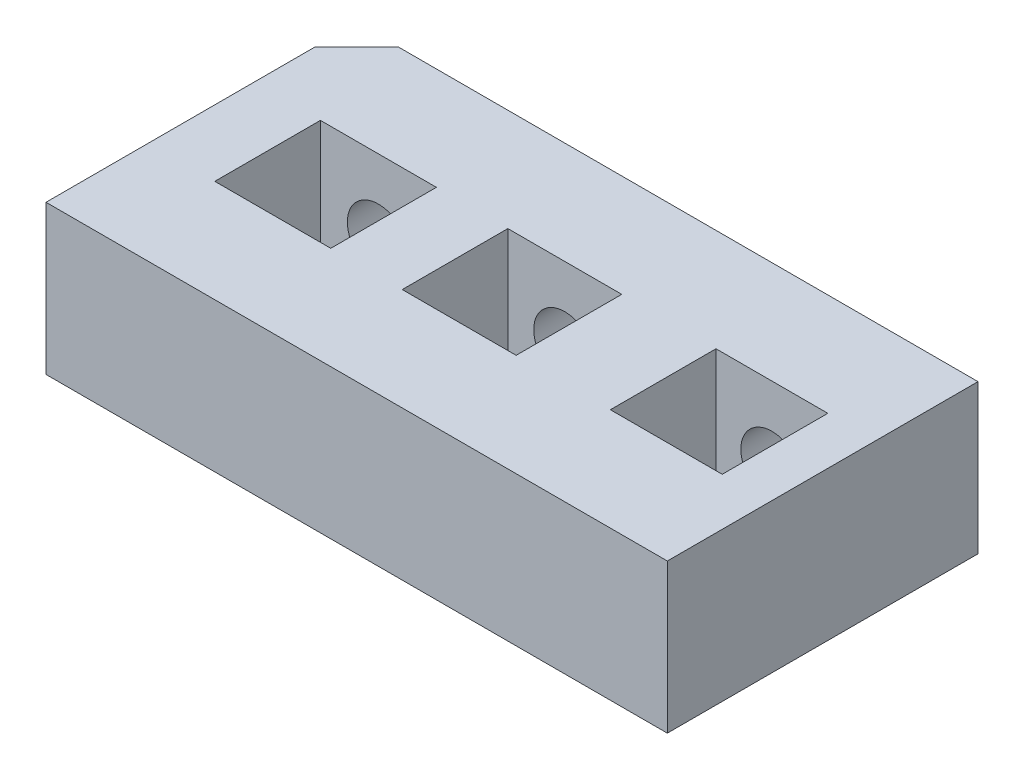
from build123d import *

# Parameters (mm, degrees)
SKETCH1_W           = 30
SKETCH1_H           = 15
BOSS_EXTRUDE1_DEPTH = 7.2
SKETCH2_W           = 5.6
SKETCH2_H           = 5.1
SKETCH2_W_2         = 5.5
SKETCH2_W_3         = 5.4
CUT_EXTRUDE1_DEPTH  = 7.2
SKETCH4_R           = 1.5
CUT_EXTRUDE2_DEPTH  = 7.2
CHAMFER1_SIZE       = 2


with BuildPart() as part:
    # Sketch1 → Boss-Extrude1 (new body)
    with BuildSketch(Plane(origin=(0, 0, 0), x_dir=(1, 0, 0), z_dir=(0, 1, 0))):
        Rectangle(SKETCH1_W, SKETCH1_H)
    extrude(amount=BOSS_EXTRUDE1_DEPTH)

    # Sketch2 → Cut-Extrude1 (cut)
    with BuildSketch(Plane(origin=(0, 7.2, 0), x_dir=(1, 0, 0), z_dir=(0, 1, 0))):
        with Locations((-9, 0)):
            Rectangle(SKETCH2_W, SKETCH2_H)
        Rectangle(SKETCH2_W_2, SKETCH2_H)
        with Locations((10, 0)):
            Rectangle(SKETCH2_W_3, SKETCH2_H)
    extrude(amount=-CUT_EXTRUDE1_DEPTH, mode=Mode.SUBTRACT)

    # Sketch4 → Cut-Extrude2 (cut)
    with BuildSketch(Plane(origin=(0, 0, -7.5), x_dir=(-1, 0, 0), z_dir=(0, 0, -1))):
        with Locations((9, 3.6)):
            Circle(SKETCH4_R)
        with Locations((0, 3.6)):
            Circle(SKETCH4_R)
        with Locations((-10, 3.6)):
            Circle(SKETCH4_R)
    extrude(amount=-CUT_EXTRUDE2_DEPTH, mode=Mode.SUBTRACT)

    # Chamfer1
    chamfer1_edges = [part.edges().sort_by_distance(p)[0] for p in [
        (-15, 3.6, -7.5),
    ]]
    chamfer(chamfer1_edges, length=CHAMFER1_SIZE)


solid = part.part
